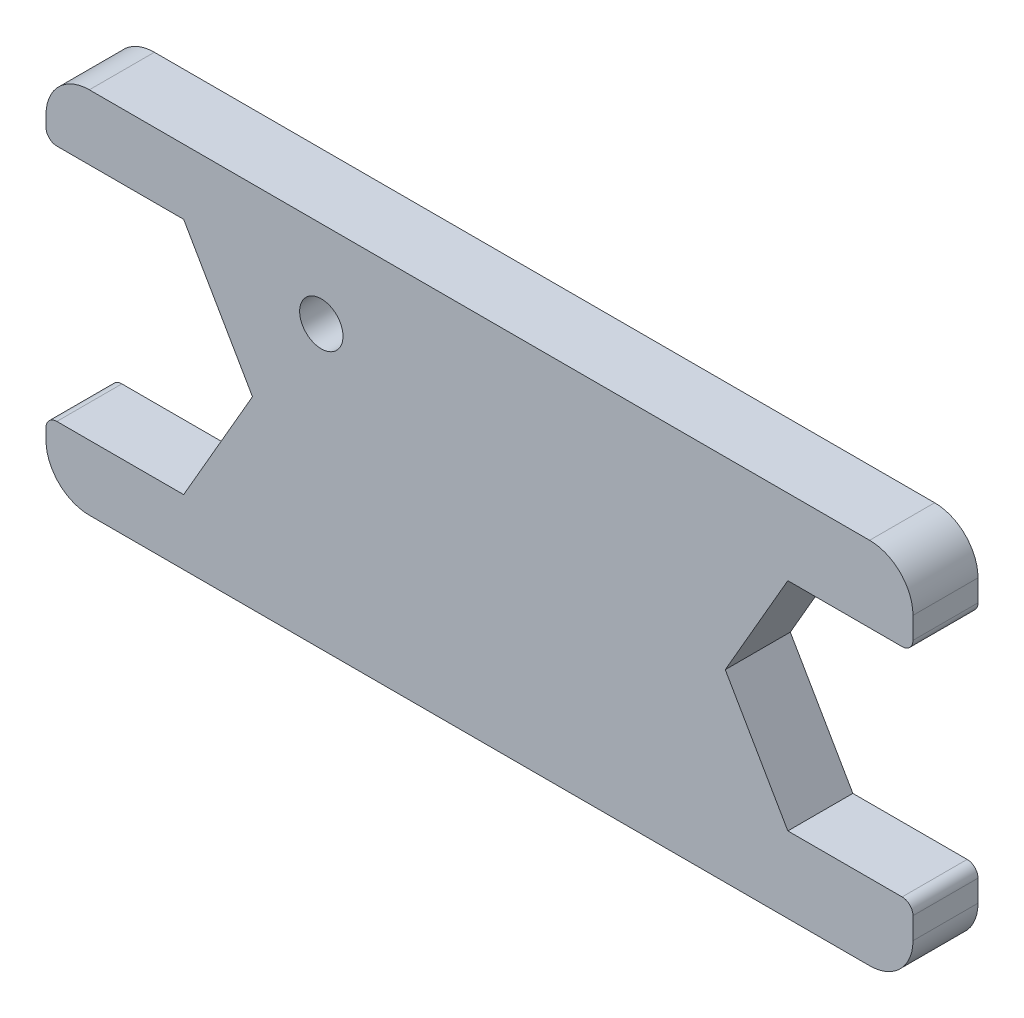
from build123d import *

# Parameters (mm, degrees)
BOSS_EXTRUDE1_DEPTH = 3
FILLET1_R           = 0.5
FILLET2_R           = 2
SKETCH2_R           = 1
CUT_EXTRUDE1_DEPTH  = 3


with BuildPart() as part:
    # Sketch1 → Boss-Extrude1 (new body)
    with BuildSketch(Plane.XY):
        Polygon((-3.175426481, 5.5), (3.175426481, 5.5), (6.350852961, 0), (3.175426481, -5.5), (-3.175426481, -5.5), (-3.175426481, -8.5), (36.824573519, -8.5), (36.824573519, -5), (31.051070828, -5), (28.164319482, 0), (31.051070828, 5), (36.824573519, 5), (36.824573519, 8.5), (-3.175426481, 8.5), align=None)
    extrude(amount=BOSS_EXTRUDE1_DEPTH)

    # Fillet1
    fillet1_edges = [part.edges().sort_by_distance(p)[0] for p in [
        (36.824573519, -5, 1.5),
        (-3.175426481, -5.5, 1.5),
        (-3.175426481, 5.5, 1.5),
        (36.824573519, 5, 1.5),
    ]]
    fillet(fillet1_edges, radius=FILLET1_R)

    # Fillet2
    fillet2_edges = [part.edges().sort_by_distance(p)[0] for p in [
        (36.824573519, -8.5, 1.5),
        (-3.175426481, -8.5, 1.5),
        (-3.175426481, 8.5, 1.5),
        (36.824573519, 8.5, 1.5),
    ]]
    fillet(fillet2_edges, radius=FILLET2_R)

    # Sketch2 → Cut-Extrude1 (cut)
    with BuildSketch(Plane.XY.offset(3)):
        with Locations((9.526279442, 4.5)):
            Circle(SKETCH2_R)
    extrude(amount=-CUT_EXTRUDE1_DEPTH, mode=Mode.SUBTRACT)


solid = part.part
